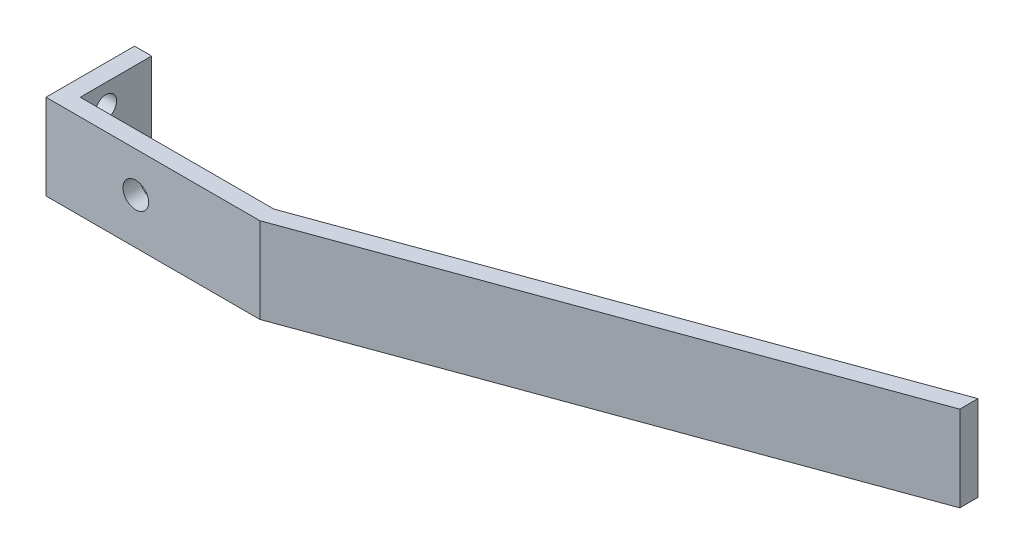
from build123d import *

# Parameters (mm, degrees)
EXTRUDE_1_DEPTH     = 20
SKETCH_2_R          = 2.5
CUT_EXTRUDE_1_DEPTH = 4
SKETCH_3_R          = 3
CUT_EXTRUDE_2_DEPTH = 4


with BuildPart() as part:
    # Эскиз1 → Бобышка-Вытянуть1 (new body)
    with BuildSketch(Plane(origin=(0, 0, 0), x_dir=(1, 0, 0), z_dir=(0, 1, 0))):
        Polygon((50, 0), (170, 43.676428112), (170, 47.933139202), (49.294692077, 4), (4, 4), (4, 20.7), (0, 20.7), (0, 4), (0, 0), align=None)
    extrude(amount=EXTRUDE_1_DEPTH)

    # Эскиз2 → Вырез-Вытянуть1 (cut)
    with BuildSketch(Plane.ZY):
        with Locations((-10, 5)):
            Circle(SKETCH_2_R)
        with Locations((-10, 15)):
            Circle(SKETCH_2_R)
    extrude(amount=-CUT_EXTRUDE_1_DEPTH, mode=Mode.SUBTRACT)

    # Эскиз3 → Вырез-Вытянуть2 (cut)
    with BuildSketch(Plane.XY):
        with Locations((21, 10.690090477)):
            Circle(SKETCH_3_R)
    extrude(amount=-CUT_EXTRUDE_2_DEPTH, mode=Mode.SUBTRACT)


solid = part.part
